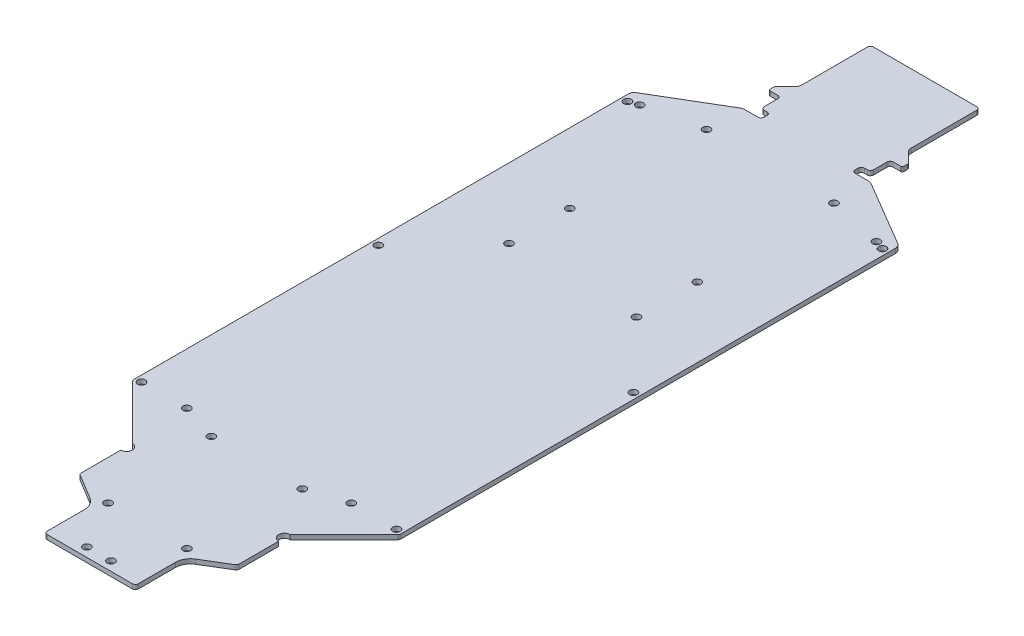
from build123d import *

# Parameters (mm, degrees)
SKETCH2_R           = 1.25
BOSS_EXTRUDE1_DEPTH = 1.5


with BuildPart() as part:
    # Sketch2 → Boss-Extrude1 (new body)
    with BuildSketch(Plane(origin=(0, 0, 0), x_dir=(1, 0, 0), z_dir=(0, 1, 0))):
        with BuildLine():
            Line((44, -37.726695025), (44, -200.585786438))
            ThreePointArc((44, -200.585786438), (43.923879533, -200.96846987), (43.707106781, -201.292893219))
            Line((43.707106781, -201.292893219), (26, -219))
            ThreePointArc((26, -219), (24.105222952, -220.894777048), (26, -222.789554095))
            Line((26, -222.789554095), (26, -235.796673544))
            ThreePointArc((26, -235.796673544), (25.871071764, -236.287829305), (25.517532037, -236.652337374))
            Line((25.517532037, -236.652337374), (17.434936424, -241.540942021))
            ThreePointArc((17.434936424, -241.540942021), (15.667237789, -243.363482369), (15.022596611, -245.819261172))
            Line((15.022596611, -245.819261172), (15.022596611, -258))
            ThreePointArc((15.022596611, -258), (14.729703393, -258.707106781), (14.022596611, -259))
            Line((14.022596611, -259), (-13.977403389, -259))
            ThreePointArc((-13.977403389, -259), (-14.68451017, -258.707106781), (-14.977403389, -258))
            Line((-14.977403389, -258), (-14.977403389, -245.819261172))
            ThreePointArc((-14.977403389, -245.819261172), (-15.622044567, -243.363482369), (-17.389743201, -241.540942021))
            Line((-17.389743201, -241.540942021), (-25.472338815, -236.652337374))
            ThreePointArc((-25.472338815, -236.652337374), (-25.825878542, -236.287829305), (-25.954806777, -235.796673544))
            Line((-25.954806777, -235.796673544), (-25.954806777, -222.789554095))
            ThreePointArc((-25.954806777, -222.789554095), (-24.06002973, -220.894777048), (-25.954806777, -219))
            Line((-25.954806777, -219), (-43.661913558, -201.292893219))
            ThreePointArc((-43.661913558, -201.292893219), (-43.87868631, -200.96846987), (-43.954806777, -200.585786438))
            Line((-43.954806777, -200.585786438), (-43.954806777, -37.726695025))
            ThreePointArc((-43.954806777, -37.726695025), (-43.692021682, -36.735693323), (-42.972722404, -36.005112097))
            Line((-42.972722404, -36.005112097), (-21.448285322, -23.278417073))
            ThreePointArc((-21.448285322, -23.278417073), (-20.958022112, -23.070859537), (-20.430369695, -23))
            Line((-20.430369695, -23), (-15.977403389, -23))
            ThreePointArc((-15.977403389, -23), (-15.270296607, -22.707106781), (-14.977403389, -22))
            Line((-14.977403389, -22), (-14.977403389, -21))
            ThreePointArc((-14.977403389, -21), (-15.270296607, -20.292893219), (-15.977403389, -20))
            Line((-15.977403389, -20), (-16.977403389, -20))
            ThreePointArc((-16.977403389, -20), (-17.68451017, -19.707106781), (-17.977403389, -19))
            Line((-17.977403389, -19), (-17.977403389, -14.507024567))
            ThreePointArc((-17.977403389, -14.507024567), (-18.270296607, -13.799917786), (-18.977403389, -13.507024567))
            Line((-18.977403389, -13.507024567), (-21.477403389, -13.507024567))
            ThreePointArc((-21.477403389, -13.507024567), (-21.830956779, -13.360577958), (-21.977403389, -13.007024567))
            Line((-21.977403389, -13.007024567), (-21.977403389, -11.921238129))
            ThreePointArc((-21.977403389, -11.921238129), (-21.901282921, -11.538554697), (-21.68451017, -11.214131348))
            Line((-21.68451017, -11.214131348), (-18.563189826, -8.092811005))
            ThreePointArc((-18.563189826, -8.092811005), (-18.129644324, -7.443964307), (-17.977403389, -6.678597442))
            Line((-17.977403389, -6.678597442), (-17.977403389, 15))
            ThreePointArc((-17.977403389, 15), (-17.68451017, 15.707106781), (-16.977403389, 16))
            Line((-16.977403389, 16), (17.022596611, 16))
            ThreePointArc((17.022596611, 16), (17.729703393, 15.707106781), (18.022596611, 15))
            Line((18.022596611, 15), (18.022596611, -6.678597442))
            ThreePointArc((18.022596611, -6.678597442), (18.174837546, -7.443964307), (18.608383049, -8.092811005))
            Line((18.608383049, -8.092811005), (21.729703393, -11.214131348))
            ThreePointArc((21.729703393, -11.214131348), (21.946476144, -11.538554697), (22.022596611, -11.921238129))
            Line((22.022596611, -11.921238129), (22.022596611, -13.007024567))
            ThreePointArc((22.022596611, -13.007024567), (21.876150002, -13.360577958), (21.522596611, -13.507024567))
            Line((21.522596611, -13.507024567), (19.022596611, -13.507024567))
            ThreePointArc((19.022596611, -13.507024567), (18.31548983, -13.799917786), (18.022596611, -14.507024567))
            Line((18.022596611, -14.507024567), (18.022596611, -19))
            ThreePointArc((18.022596611, -19), (17.729703393, -19.707106781), (17.022596611, -20))
            Line((17.022596611, -20), (16.022596611, -20))
            ThreePointArc((16.022596611, -20), (15.31548983, -20.292893219), (15.022596611, -21))
            Line((15.022596611, -21), (15.022596611, -22))
            ThreePointArc((15.022596611, -22), (15.31548983, -22.707106781), (16.022596611, -23))
            Line((16.022596611, -23), (20.475562918, -23))
            ThreePointArc((20.475562918, -23), (21.003215334, -23.070859537), (21.493478545, -23.278417073))
            Line((21.493478545, -23.278417073), (43.017915627, -36.005112097))
            ThreePointArc((43.017915627, -36.005112097), (43.737214905, -36.735693323), (44, -37.726695025))
        make_face()
        with Locations(Location((42, -200, 0), (0, 0, 270))):
            Circle(SKETCH2_R, mode=Mode.SUBTRACT)
        with Locations(Location((27.091305327, -200, 0), (0, 0, 270))):
            Circle(SKETCH2_R, mode=Mode.SUBTRACT)
        with Locations(Location((4, -256, 0), (0, 0, 270))):
            Circle(SKETCH2_R, mode=Mode.SUBTRACT)
        with Locations(Location((13, -240, 0), (0, 0, 270))):
            Circle(SKETCH2_R, mode=Mode.SUBTRACT)
        with Locations(Location((15, -204, 0), (0, 0, 270))):
            Circle(SKETCH2_R, mode=Mode.SUBTRACT)
        with Locations(Location((42, -40, 0), (0, 0, 270))):
            Circle(SKETCH2_R, mode=Mode.SUBTRACT)
        with Locations(Location((39, -39, 0), (0, 0, 270))):
            Circle(SKETCH2_R, mode=Mode.SUBTRACT)
        with Locations(Location((21, -35, 0), (0, 0, 270))):
            Circle(SKETCH2_R, mode=Mode.SUBTRACT)
        with Locations(Location((42, -122, 0), (0, 0, 270))):
            Circle(SKETCH2_R, mode=Mode.SUBTRACT)
        with Locations(Location((21, -100, 0), (0, 0, 270))):
            Circle(SKETCH2_R, mode=Mode.SUBTRACT)
        with Locations(Location((21, -80, 0), (0, 0, 270))):
            Circle(SKETCH2_R, mode=Mode.SUBTRACT)
        with Locations(Location((-20.954806777, -80, 0), (0, 0, 270))):
            Circle(SKETCH2_R, mode=Mode.SUBTRACT)
        with Locations(Location((-20.954806777, -100, 0), (0, 0, 270))):
            Circle(SKETCH2_R, mode=Mode.SUBTRACT)
        with Locations(Location((-41.954806777, -122, 0), (0, 0, 270))):
            Circle(SKETCH2_R, mode=Mode.SUBTRACT)
        with Locations(Location((-20.954806777, -35, 0), (0, 0, 270))):
            Circle(SKETCH2_R, mode=Mode.SUBTRACT)
        with Locations(Location((-38.954806777, -39, 0), (0, 0, 270))):
            Circle(SKETCH2_R, mode=Mode.SUBTRACT)
        with Locations(Location((-41.954806777, -40, 0), (0, 0, 270))):
            Circle(SKETCH2_R, mode=Mode.SUBTRACT)
        with Locations(Location((-14.954806777, -204, 0), (0, 0, 270))):
            Circle(SKETCH2_R, mode=Mode.SUBTRACT)
        with Locations(Location((-12.954806777, -240, 0), (0, 0, 270))):
            Circle(SKETCH2_R, mode=Mode.SUBTRACT)
        with Locations(Location((-3.954806777, -256, 0), (0, 0, 270))):
            Circle(SKETCH2_R, mode=Mode.SUBTRACT)
        with Locations(Location((-27.046112104, -200, 0), (0, 0, 270))):
            Circle(SKETCH2_R, mode=Mode.SUBTRACT)
        with Locations(Location((-41.954806777, -200, 0), (0, 0, 270))):
            Circle(SKETCH2_R, mode=Mode.SUBTRACT)
    extrude(amount=BOSS_EXTRUDE1_DEPTH)


solid = part.part
